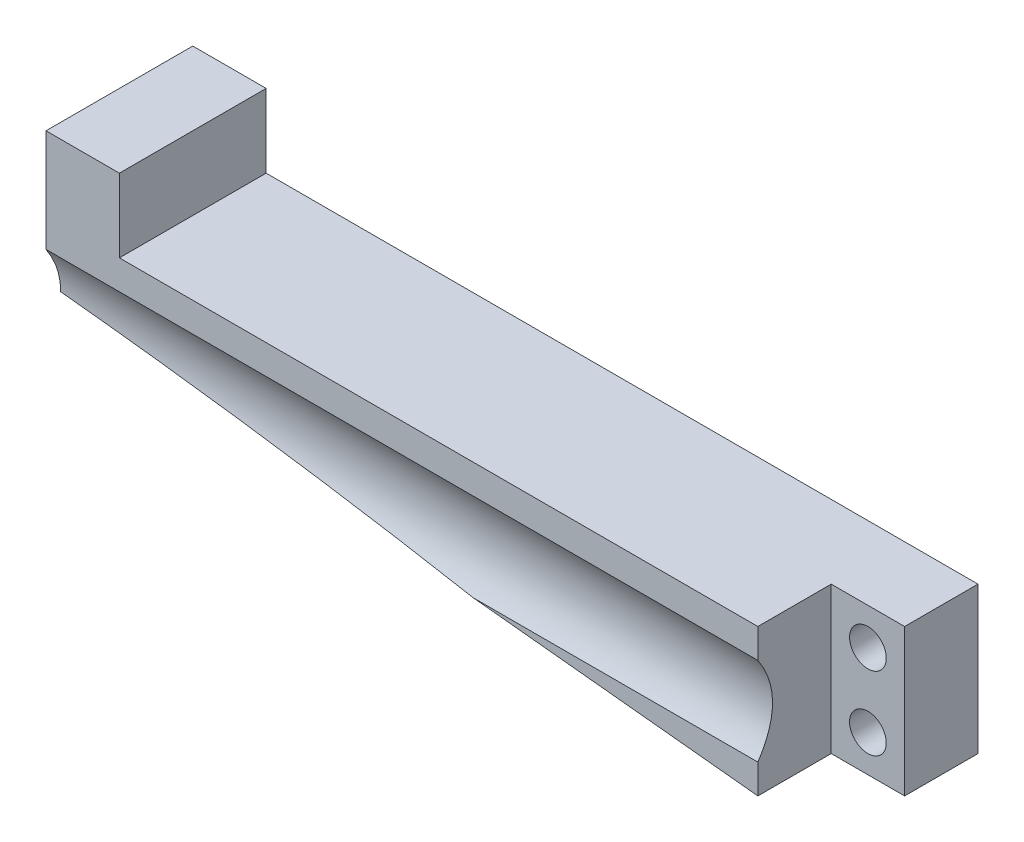
from build123d import *

# Parameters (mm, degrees)
ESQUISSE1_R             = 2.5
BOSS_EXTRU_1_DEPTH      = 20
ESQUISSE2_W             = 10
ESQUISSE2_H             = 20
ENL_V_MAT_EXTRU_1_DEPTH = 10
ENL_V_MAT_EXTRU_2_REACH = 112.675


with BuildPart() as part:
    # Esquisse1 → Boss.-Extru.1 (new body)
    with BuildSketch(Plane.XY):
        Polygon((-102, 0), (-5, -10), (5, -10), (5, 10), (-5, 10), (-92, 10), (-92, 20), (-102, 20), (-102, 10), align=None)
        with Locations((0, 5)):
            Circle(ESQUISSE1_R, mode=Mode.SUBTRACT)
        with Locations((0, -5)):
            Circle(ESQUISSE1_R, mode=Mode.SUBTRACT)
    extrude(amount=BOSS_EXTRU_1_DEPTH)

    # Esquisse2 → Enlèv. mat.-Extru.1 (cut)
    with BuildSketch(Plane.XY.offset(20)):
        Rectangle(ESQUISSE2_W, ESQUISSE2_H)
    extrude(amount=-ENL_V_MAT_EXTRU_1_DEPTH, mode=Mode.SUBTRACT)

    # Enlèv. mat.-Extru.2: up to this face of the body (flat: up to its plane)
    enl_v_mat_extru_2_end = Plane(part.part.faces().sort_by_distance((-5, 0, 15))[0])
    # Esquisse4 → Enlèv. mat.-Extru.2 (cut, up to the picked face)
    with BuildSketch(Plane.ZY.offset(102), mode=Mode.PRIVATE) as enl_v_mat_extru_2_sk1:
        with BuildLine():
            Line((20, 6), (20, -6))
            add(Edge.make_bspline(
                [(20, 6), (16, 0), (20, -6)],
                knots=[0, 0, 0, 1, 1, 1], degree=2))
        make_face()
    enl_v_mat_extru_2_tool1 = split(extrude(enl_v_mat_extru_2_sk1.sketch, amount=-ENL_V_MAT_EXTRU_2_REACH, mode=Mode.PRIVATE), bisect_by=enl_v_mat_extru_2_end, keep=Keep.BOTH, mode=Mode.PRIVATE)
    add(enl_v_mat_extru_2_tool1.solids().sort_by(Axis((-102, 0, 19.2), (1, 0, 0)))[0], mode=Mode.SUBTRACT)


solid = part.part
